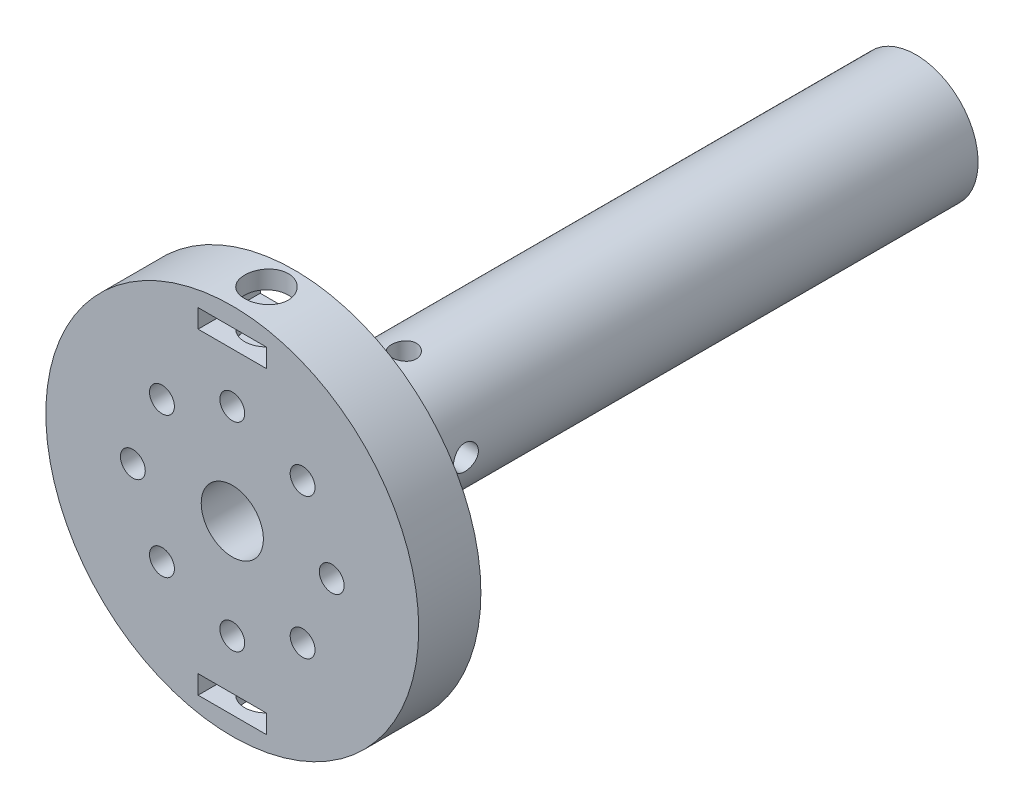
from build123d import *

# Parameters (mm, degrees)
SKETCH1_R               = 30
BOSS_EXTRUDE1_DEPTH     = 10
SKETCH2_R               = 10
BOSS_EXTRUDE2_DEPTH     = 100
SKETCH2_2_R             = 10
BOSS_EXTRUDE3_DEPTH     = 20
SKETCH5_R               = 5
CUT_EXTRUDE1_DEPTH      = 118.898261226
SKETCH6_R               = 2
CUT_EXTRUDE2_DEPTH      = 109.627804912
CIRPATTERN1_COUNT       = 2
CIRPATTERN1_ANGLE       = 90
CUT_EXTRUDE3_DEPTH      = 118.898261319
CUT_EXTRUDE3_DEPTH_BACK = 118.898261319
SKETCH7_R               = 2
SKETCH9_W               = 11
SKETCH9_H               = 3
CUT_EXTRUDE5_DEPTH      = 10
SKETCH10_R              = 3.5
CUT_EXTRUDE6_DEPTH      = 8
SKETCH17_R              = 7.355644599
BOSS_EXTRUDE4_DEPTH     = 25
SKETCH18_R              = 3
CUT_EXTRUDE7_DEPTH      = 15
BOSS_EXTRUDE5_START     = 10
BOSS_EXTRUDE5_DEPTH     = 10


with BuildPart() as part:
    # Sketch1 → Boss-Extrude1 (new body)
    with BuildSketch(Plane.XY):
        Circle(SKETCH1_R)
    extrude(amount=BOSS_EXTRUDE1_DEPTH)

    # Sketch2 → Boss-Extrude2 (add)
    with BuildSketch(Plane(origin=(0, 0, 0), x_dir=(-1, 0, 0), z_dir=(0, 0, -1))):
        Circle(SKETCH2_R)
    extrude(amount=BOSS_EXTRUDE2_DEPTH)

    # Sketch2<2> → Boss-Extrude3 (add)
    with BuildSketch(Plane(origin=(0, 0, 0), x_dir=(-1, 0, 0), z_dir=(0, 0, -1))):
        Circle(SKETCH2_2_R)
    extrude(amount=BOSS_EXTRUDE3_DEPTH)

    # Sketch5 → Cut-Extrude1 (cut, through all)
    with BuildSketch(Plane(origin=(0, 0, -100), x_dir=(-1, 0, 0), z_dir=(0, 0, -1))):
        Circle(SKETCH5_R)
    extrude(amount=-CUT_EXTRUDE1_DEPTH, mode=Mode.SUBTRACT)

    # Sketch6 → Cut-Extrude2 (cut, symmetric)
    with BuildSketch(Plane(origin=(0, 0, 0), x_dir=(1, 0, 0), z_dir=(0, 1, 0))):
        with Locations((0, 17.6)):
            Circle(SKETCH6_R)
    cut_extrude2 = extrude(amount=CUT_EXTRUDE2_DEPTH, both=True, mode=Mode.SUBTRACT)

    # CirPattern1: Cut-Extrude2 ×2 about axis
    cirpattern1_axis = Axis((0, 0, -100), (0, 0, 1))
    for i in range(1, CIRPATTERN1_COUNT):
        add(cut_extrude2.rotate(cirpattern1_axis, i * CIRPATTERN1_ANGLE / (CIRPATTERN1_COUNT - 1)), mode=Mode.SUBTRACT)

    # Sketch7 → Cut-Extrude3 (cut, two sides: drawn at the far end of the back side and taken through both)
    with BuildSketch(Plane.XY.offset(10).offset(-CUT_EXTRUDE3_DEPTH_BACK)):
        with Locations((0, 16)):
            Circle(SKETCH7_R)
        with Locations((11.313708499, 11.313708499)):
            Circle(SKETCH7_R)
        with Locations((16, 0)):
            Circle(SKETCH7_R)
        with Locations((11.313708499, -11.313708499)):
            Circle(SKETCH7_R)
        with Locations((0, -16)):
            Circle(SKETCH7_R)
        with Locations((-11.313708499, -11.313708499)):
            Circle(SKETCH7_R)
        with Locations((-16, 0)):
            Circle(SKETCH7_R)
        with Locations((-11.313708499, 11.313708499)):
            Circle(SKETCH7_R)
    extrude(amount=CUT_EXTRUDE3_DEPTH + CUT_EXTRUDE3_DEPTH_BACK, mode=Mode.SUBTRACT)

    # Sketch9 → Cut-Extrude5 (cut)
    with BuildSketch(Plane(origin=(0, 0, 0), x_dir=(-1, 0, 0), z_dir=(0, 0, -1))):
        with Locations((0, 25.5)):
            Rectangle(SKETCH9_W, SKETCH9_H)
    cut_extrude5 = extrude(amount=-CUT_EXTRUDE5_DEPTH, mode=Mode.SUBTRACT)

    # Mirror1: Cut-Extrude5 across plane
    add(cut_extrude5.mirror(Plane.ZX), mode=Mode.SUBTRACT)

    # Sketch10 → Cut-Extrude6 (cut)
    with BuildSketch(Plane(origin=(0, -30, 0), x_dir=(-1, 0, 0), z_dir=(0, -1, 0))):
        with Locations((0, -4.5)):
            Circle(SKETCH10_R)
    cut_extrude6 = extrude(amount=-CUT_EXTRUDE6_DEPTH, mode=Mode.SUBTRACT)

    # Mirror2: Cut-Extrude6 across plane
    add(cut_extrude6.mirror(Plane.ZX), mode=Mode.SUBTRACT)

    # Sketch17 → Boss-Extrude4 (add)
    with BuildSketch(Plane(origin=(0, 0, -75), x_dir=(-1, 0, 0), z_dir=(0, 0, -1))):
        Circle(SKETCH17_R)
    extrude(amount=BOSS_EXTRUDE4_DEPTH)

    # Sketch18 → Cut-Extrude7 (cut)
    with BuildSketch(Plane(origin=(0, 0, -100), x_dir=(-1, 0, 0), z_dir=(0, 0, -1))):
        Circle(SKETCH18_R)
    extrude(amount=-CUT_EXTRUDE7_DEPTH, mode=Mode.SUBTRACT)

    # Sketch19 → Boss-Extrude5 (add)
    with BuildSketch(Plane(origin=(0, 0, -85), x_dir=(-1, 0, 0), z_dir=(0, 0, -1)).offset(BOSS_EXTRUDE5_START)):
        with BuildLine():
            Line((1.658312395, 2.5), (-1.658312395, 2.5))
            ThreePointArc((-1.658312395, 2.5), (0, 3), (1.658312395, 2.5))
        make_face()
    extrude(amount=-BOSS_EXTRUDE5_DEPTH)


solid = part.part
